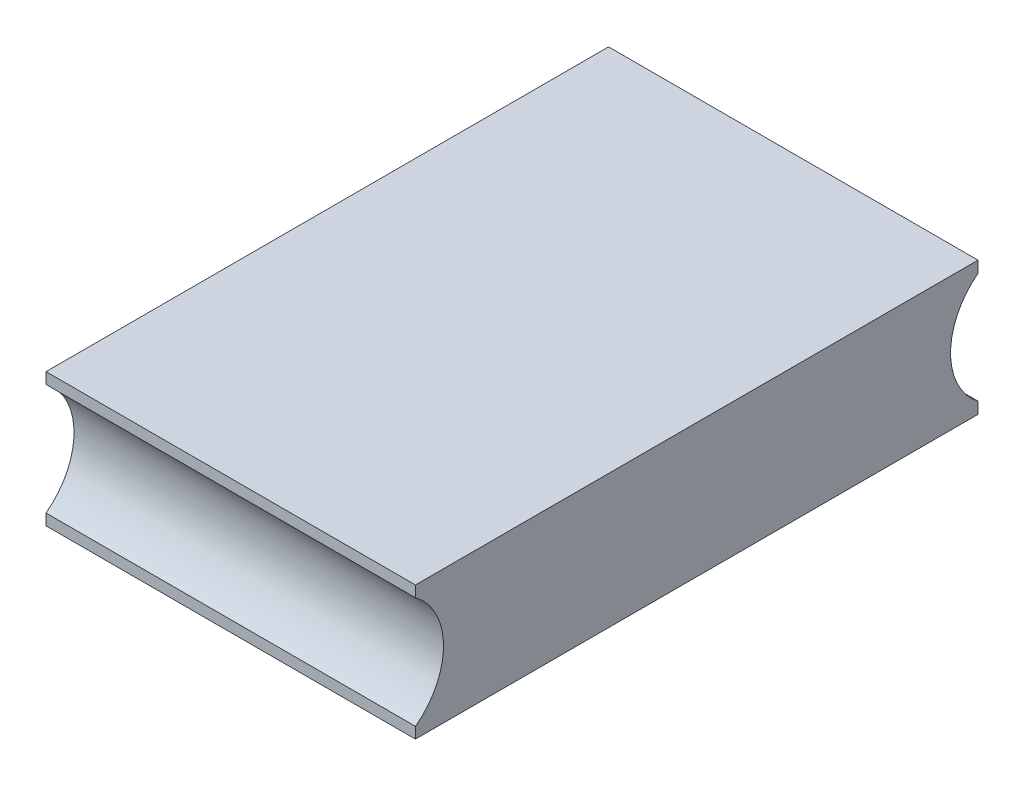
from build123d import *

# Parameters (mm, degrees)
EXTRUDE_1_DEPTH = 40


with BuildPart() as part:
    # 스케치1 → 보스-돌출1 (new, symmetric)
    with BuildSketch(Plane(origin=(0, 0, 0), x_dir=(0, 0, -1), z_dir=(1, 0, 0))):
        with BuildLine():
            Line((-69.266962805, 12.052065062), (-69.266962805, 14.456832295))
            Line((-69.266962805, 14.456832295), (52.54084866, 14.456832295))
            Line((52.54084866, 14.456832295), (52.54084866, 11.97798599))
            ThreePointArc((52.54084866, 11.97798599), (46.598017754, 0), (52.54084866, -11.97798599))
            Line((52.54084866, -11.97798599), (52.54084866, -14.456832295))
            Line((52.54084866, -14.456832295), (-69.266962805, -14.456832295))
            Line((-69.266962805, -14.456832295), (-69.266962805, -12.052065062))
            ThreePointArc((-69.266962805, -12.052065062), (-63.197121131, 0), (-69.266962805, 12.052065062))
        make_face()
    extrude(amount=EXTRUDE_1_DEPTH, both=True)


solid = part.part
